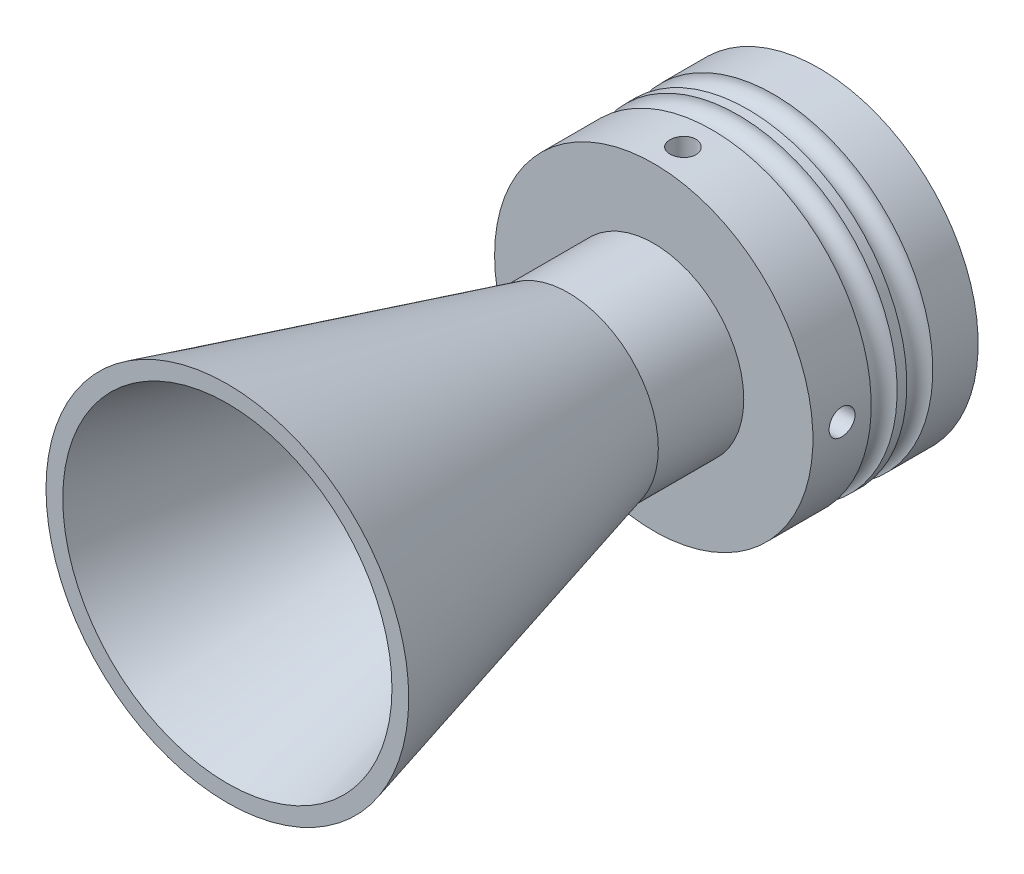
from build123d import *

# Parameters (mm, degrees)
F_4_0MM_DOWEL_HOLE1_D               = 4
F_4_0MM_DOWEL_HOLE1_DEPTH           = 5
F_4_0MM_DOWEL_HOLE1_TIP             = 1.201721238
F_4_0MM_DOWEL_HOLE1_ON_FACE_2_D     = 4
F_4_0MM_DOWEL_HOLE1_ON_FACE_2_DEPTH = 5
F_4_0MM_DOWEL_HOLE1_ON_FACE_2_TIP   = 1.201721238
F_4_0MM_DOWEL_HOLE1_ON_FACE_3_D     = 4
F_4_0MM_DOWEL_HOLE1_ON_FACE_3_DEPTH = 5
F_4_0MM_DOWEL_HOLE1_ON_FACE_3_TIP   = 1.201721238
F_4_0MM_DOWEL_HOLE1_ON_FACE_4_D     = 4
F_4_0MM_DOWEL_HOLE1_ON_FACE_4_DEPTH = 5
F_4_0MM_DOWEL_HOLE1_ON_FACE_4_TIP   = 1.201721238
F_4_0MM_DOWEL_HOLE1_ON_FACE_5_D     = 4
F_4_0MM_DOWEL_HOLE1_ON_FACE_5_DEPTH = 5
F_4_0MM_DOWEL_HOLE1_ON_FACE_5_TIP   = 1.201721238


with BuildPart() as part:
    # Sketch1 → Revolve2 (revolve)
    with BuildSketch(Plane(origin=(0, 0, 0), x_dir=(1, 0, 0), z_dir=(0, 1, 0)), mode=Mode.PRIVATE) as revolve2_sk:
        with BuildLine():
            Line((24.5618, 27.144353846), (8.89, 0))
            Line((8.89, 0), (8.89, -2.54))
            Line((8.89, -2.54), (25.4, -64.156158833))
            Line((25.4, -64.156158833), (27.988190451, -64.156158833))
            Line((27.988190451, -64.156158833), (13.89, -11.540995775))
            Line((13.89, -11.540995775), (13.89, 1.644353846))
            Line((13.89, 1.644353846), (24.5618, 1.644353846))
            Line((24.5618, 1.644353846), (24.5618, 10.644353846))
            ThreePointArc((24.5618, 10.644353846), (22.5618, 12.644353846), (24.5618, 14.644353846))
            Line((24.5618, 14.644353846), (24.5618, 16.144353846))
            ThreePointArc((24.5618, 16.144353846), (22.5618, 18.144353846), (24.5618, 20.144353846))
            Line((24.5618, 20.144353846), (24.5618, 27.144353846))
        make_face()
    revolve(revolve2_sk.sketch.rotate(Axis((0, 0, -75.308440558), (0, 0, 1)), 180), axis=Axis((0, 0, -75.308440558), (0, 0, 1)))

    # Ø4.0mm Dowel Hole1
    with Locations(Plane(origin=(-24.5618, 0, -6.144353846), x_dir=(0, -1, 0), z_dir=(-1, 0, 0))):
        with Locations((0, 0)):
            Hole(F_4_0MM_DOWEL_HOLE1_D / 2, depth=F_4_0MM_DOWEL_HOLE1_DEPTH)
            with Locations((0, 0, -(F_4_0MM_DOWEL_HOLE1_DEPTH + F_4_0MM_DOWEL_HOLE1_TIP / 2))):  # 118° drill point
                Cone(0, F_4_0MM_DOWEL_HOLE1_D / 2, F_4_0MM_DOWEL_HOLE1_TIP, mode=Mode.SUBTRACT)

    # Ø4.0mm Dowel Hole1 on face 2
    with Locations(Plane(origin=(0, 0, 0), x_dir=(0, -1, 0), z_dir=(-1, 0, 0))):
        with Locations((0, 0)):
            Hole(F_4_0MM_DOWEL_HOLE1_ON_FACE_2_D / 2, depth=F_4_0MM_DOWEL_HOLE1_ON_FACE_2_DEPTH)
            with Locations((0, 0, -(F_4_0MM_DOWEL_HOLE1_ON_FACE_2_DEPTH + F_4_0MM_DOWEL_HOLE1_ON_FACE_2_TIP / 2))):  # 118° drill point
                Cone(0, F_4_0MM_DOWEL_HOLE1_ON_FACE_2_D / 2, F_4_0MM_DOWEL_HOLE1_ON_FACE_2_TIP, mode=Mode.SUBTRACT)

    # Ø4.0mm Dowel Hole1 on face 3
    with Locations(Plane(origin=(0, 24.5618, -6.144353846), x_dir=(0, 0, 1), z_dir=(0, 1, 0))):
        with Locations((0, 0)):
            Hole(F_4_0MM_DOWEL_HOLE1_ON_FACE_3_D / 2, depth=F_4_0MM_DOWEL_HOLE1_ON_FACE_3_DEPTH)
            with Locations((0, 0, -(F_4_0MM_DOWEL_HOLE1_ON_FACE_3_DEPTH + F_4_0MM_DOWEL_HOLE1_ON_FACE_3_TIP / 2))):  # 118° drill point
                Cone(0, F_4_0MM_DOWEL_HOLE1_ON_FACE_3_D / 2, F_4_0MM_DOWEL_HOLE1_ON_FACE_3_TIP, mode=Mode.SUBTRACT)

    # Ø4.0mm Dowel Hole1 on face 4
    with Locations(Plane(origin=(24.5618, 0, -6.144353846), x_dir=(0, 0, 1), z_dir=(1, 0, 0))):
        with Locations((0, 0)):
            Hole(F_4_0MM_DOWEL_HOLE1_ON_FACE_4_D / 2, depth=F_4_0MM_DOWEL_HOLE1_ON_FACE_4_DEPTH)
            with Locations((0, 0, -(F_4_0MM_DOWEL_HOLE1_ON_FACE_4_DEPTH + F_4_0MM_DOWEL_HOLE1_ON_FACE_4_TIP / 2))):  # 118° drill point
                Cone(0, F_4_0MM_DOWEL_HOLE1_ON_FACE_4_D / 2, F_4_0MM_DOWEL_HOLE1_ON_FACE_4_TIP, mode=Mode.SUBTRACT)

    # Ø4.0mm Dowel Hole1 on face 5
    with Locations(Plane(origin=(0, -24.5618, -6.144353846), x_dir=(0, 0, -1), z_dir=(0, -1, 0))):
        with Locations((0, 0)):
            Hole(F_4_0MM_DOWEL_HOLE1_ON_FACE_5_D / 2, depth=F_4_0MM_DOWEL_HOLE1_ON_FACE_5_DEPTH)
            with Locations((0, 0, -(F_4_0MM_DOWEL_HOLE1_ON_FACE_5_DEPTH + F_4_0MM_DOWEL_HOLE1_ON_FACE_5_TIP / 2))):  # 118° drill point
                Cone(0, F_4_0MM_DOWEL_HOLE1_ON_FACE_5_D / 2, F_4_0MM_DOWEL_HOLE1_ON_FACE_5_TIP, mode=Mode.SUBTRACT)


solid = part.part
